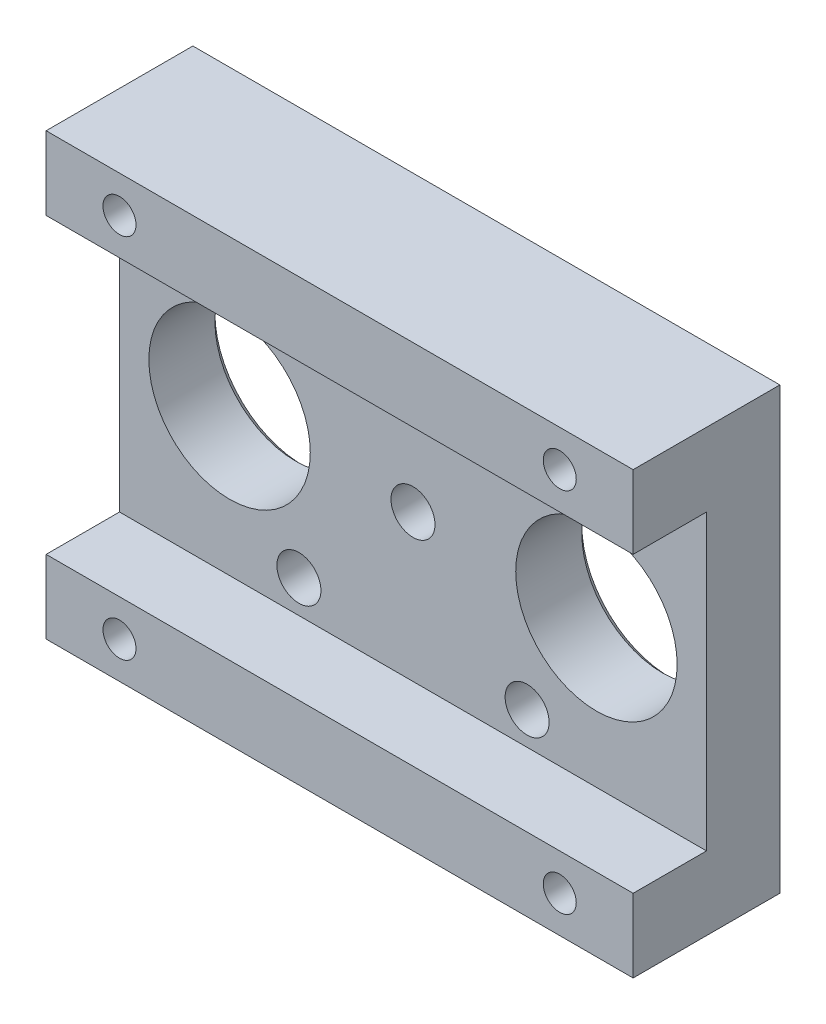
from build123d import *

# Parameters (mm, degrees)
SKIZZE1_W                       = 80
SKIZZE1_H                       = 60
AUFSATZ_LINEAR_AUSTRAGEN1_DEPTH = 10
SKIZZE2_W                       = 80
SKIZZE2_H                       = 10
AUFSATZ_LINEAR_AUSTRAGEN2_DEPTH = 10
SKIZZE3_R                       = 11.35
SCHNITT_LINEAR_AUSTRAGEN1_DEPTH = 2.2
SKIZZE4_R                       = 3
SCHNITT_LINEAR_AUSTRAGEN2_DEPTH = 12.2
SKIZZE5_R                       = 2.25
SCHNITT_LINEAR_AUSTRAGEN3_DEPTH = 12.2
SKIZZE6_R                       = 11
SCHNITT_LINEAR_AUSTRAGEN4_DEPTH = 12.2
SKIZZE7_R                       = 1.6
SCHNITT_LINEAR_AUSTRAGEN5_DEPTH = 12.2
SKIZZE8_R                       = 3
SCHNITT_LINEAR_AUSTRAGEN6_DEPTH = 6
FASE1_SIZE                      = 1


with BuildPart() as part:
    # Skizze1 → Aufsatz-Linear austragen1 (new body)
    with BuildSketch(Plane.XY):
        Rectangle(SKIZZE1_W, SKIZZE1_H)
    extrude(amount=AUFSATZ_LINEAR_AUSTRAGEN1_DEPTH)

    # Skizze2 → Aufsatz-Linear austragen2 (add)
    with BuildSketch(Plane.XY.offset(10)):
        with Locations((0, 25)):
            Rectangle(SKIZZE2_W, SKIZZE2_H)
        with Locations((0, -25)):
            Rectangle(SKIZZE2_W, SKIZZE2_H)
    extrude(amount=AUFSATZ_LINEAR_AUSTRAGEN2_DEPTH)

    # Skizze3 → Schnitt-Linear austragen1 (cut)
    with BuildSketch(Plane(origin=(0, 0, 0), x_dir=(-1, 0, 0), z_dir=(0, 0, -1))):
        Circle(SKIZZE3_R)
    extrude(amount=-SCHNITT_LINEAR_AUSTRAGEN1_DEPTH, mode=Mode.SUBTRACT)

    # Skizze4 → Schnitt-Linear austragen2 (cut)
    with BuildSketch(Plane(origin=(0, 0, 2.2), x_dir=(-1, 0, 0), z_dir=(0, 0, -1))):
        Circle(SKIZZE4_R)
    extrude(amount=-SCHNITT_LINEAR_AUSTRAGEN2_DEPTH, mode=Mode.SUBTRACT)

    # Skizze5 → Schnitt-Linear austragen3 (cut)
    with BuildSketch(Plane.XY.offset(20)):
        with Locations((30, 25)):
            Circle(SKIZZE5_R)
        with Locations((-30, 25)):
            Circle(SKIZZE5_R)
        with Locations((-30, -25)):
            Circle(SKIZZE5_R)
        with Locations((30, -25)):
            Circle(SKIZZE5_R)
    extrude(amount=-SCHNITT_LINEAR_AUSTRAGEN3_DEPTH, mode=Mode.SUBTRACT)

    # Skizze6 → Schnitt-Linear austragen4 (cut)
    with BuildSketch(Plane.XY.offset(10)):
        with Locations((-25, 0)):
            Circle(SKIZZE6_R)
        with Locations((25, 0)):
            Circle(SKIZZE6_R)
    extrude(amount=-SCHNITT_LINEAR_AUSTRAGEN4_DEPTH, mode=Mode.SUBTRACT)

    # Skizze7 → Schnitt-Linear austragen5 (cut)
    with BuildSketch(Plane.XY.offset(10)):
        with Locations((-15.55, 15.55)):
            Circle(SKIZZE7_R)
        with Locations((15.55, 15.55)):
            Circle(SKIZZE7_R)
        with Locations((15.55, -15.55)):
            Circle(SKIZZE7_R)
        with Locations((-15.55, -15.55)):
            Circle(SKIZZE7_R)
    extrude(amount=-SCHNITT_LINEAR_AUSTRAGEN5_DEPTH, mode=Mode.SUBTRACT)

    # Skizze8 → Schnitt-Linear austragen6 (cut)
    with BuildSketch(Plane.XY.offset(10)):
        with Locations((-15.55, 15.55)):
            Circle(SKIZZE8_R)
        with Locations((15.55, 15.55)):
            Circle(SKIZZE8_R)
        with Locations((-15.55, -15.55)):
            Circle(SKIZZE8_R)
        with Locations((15.55, -15.55)):
            Circle(SKIZZE8_R)
    extrude(amount=-SCHNITT_LINEAR_AUSTRAGEN6_DEPTH, mode=Mode.SUBTRACT)

    # Fase1
    fase1_edges = [part.edges().sort_by_distance(p)[0] for p in [
        (-36, 0, 0),
        (14, 0, 0),
    ]]
    chamfer(fase1_edges, length=FASE1_SIZE)


solid = part.part
